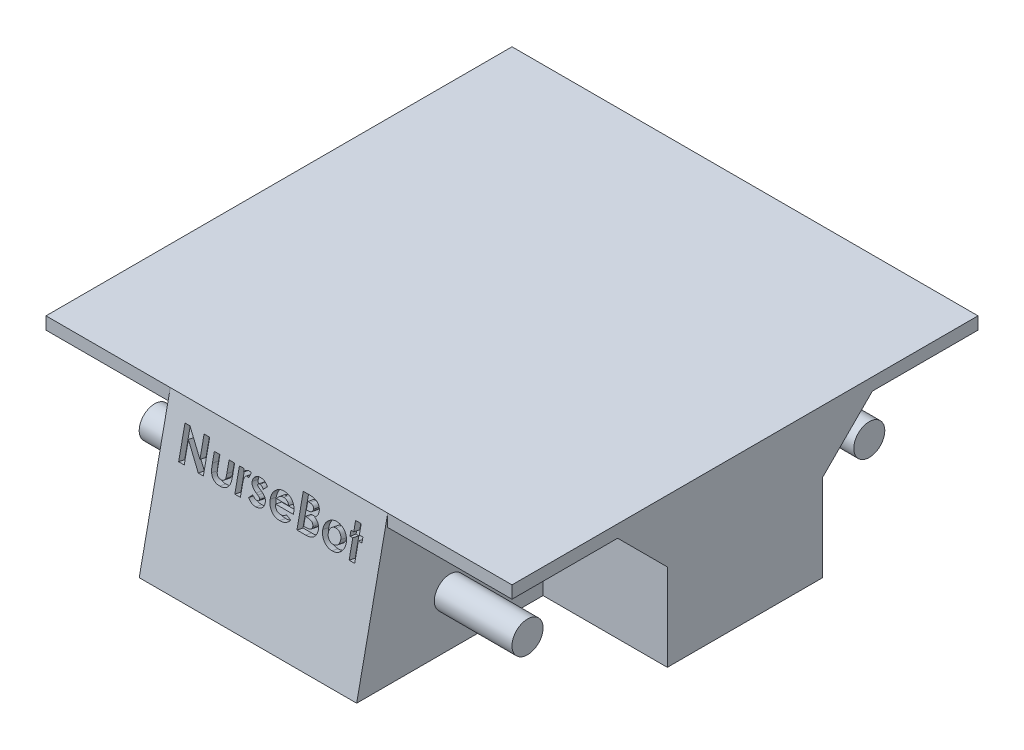
from build123d import *

# Parameters (mm, degrees)
SKETCH1_W                = 750
SKETCH1_H                = 750
BOSS_EXTRUDE1_DEPTH      = 20
BOSS_EXTRUDE5_DEPTH      = 220
BOSS_EXTRUDE6_DEPTH      = 300
BOSS_EXTRUDE6_DEPTH_BACK = 300
SKETCH7_R                = 25
CHAMFER2_SIZE            = 80
BOSS_EXTRUDE7_DEPTH      = 350
CUT_EXTRUDE1_DEPTH       = 10


with BuildPart() as part:
    # Sketch1 → Boss-Extrude1 (new body)
    with BuildSketch(Plane(origin=(0, 0, 0), x_dir=(1, 0, 0), z_dir=(0, 1, 0))):
        Rectangle(SKETCH1_W, SKETCH1_H)
    extrude(amount=BOSS_EXTRUDE1_DEPTH)

    # Sketch6 → Boss-Extrude5 (add)
    with BuildSketch(Plane(origin=(0, 0, 0), x_dir=(-1, 0, 0), z_dir=(0, -1, 0))):
        Polygon((175, -375), (175, -125), (375, -125), (375, 125), (175, 125), (175, 375), (-175, 375), (-175, 125), (-375, 125), (-375, -125), (-175, -125), (-175, -375), align=None)
    extrude(amount=BOSS_EXTRUDE5_DEPTH)

    # Sketch7 → Boss-Extrude6 (add, two sides: drawn at the far end of the back side and taken through both)
    with BuildSketch(Plane(origin=(0, 0, 0), x_dir=(0, 0, -1), z_dir=(1, 0, 0)).offset(-BOSS_EXTRUDE6_DEPTH_BACK)):
        with Locations((275, -140)):
            Circle(SKETCH7_R)
        with Locations((-275, -140)):
            Circle(SKETCH7_R)
    extrude(amount=BOSS_EXTRUDE6_DEPTH + BOSS_EXTRUDE6_DEPTH_BACK)

    # Chamfer2
    chamfer2_edges = [part.edges().sort_by_distance(p)[0] for p in [
        (-275, 0, 125),
        (-275, 0, -125),
        (275, 0, -125),
        (275, 0, 125),
    ]]
    chamfer(chamfer2_edges, length=CHAMFER2_SIZE)

    # Sketch8 → Boss-Extrude7 (add)
    with BuildSketch(Plane(origin=(175, 0, 0), x_dir=(0, 0, -1), z_dir=(1, 0, 0))):
        Polygon((-375, -220), (-375, 20), (-425, -220), align=None)
    extrude(amount=-BOSS_EXTRUDE7_DEPTH)

    # Sketch9 → Cut-Extrude1 (cut)
    # profile 1 of 8: a face of its own
    with BuildSketch(Plane(origin=(0, 75.707154742, 363.394342762), x_dir=(1, 0, 0), z_dir=(0, 0.20395425411200038, 0.9789804197376052))):
        Polygon((-144.839855601, -88.611910455), (-136.756922909, -88.611910455), (-114.070624832, -121.514554686), (-114.070624832, -88.611910455), (-105.096265857, -88.611910455), (-105.096265857, -138.611910455), (-113.239294703, -138.611910455), (-135.865496626, -105.809426481), (-135.865496626, -138.611910455), (-144.839855601, -138.611910455), align=None)
    # profile 2 of 8: a face of its own
    with BuildSketch(Plane(origin=(0, 75.707154742, 363.394342762), x_dir=(1, 0, 0), z_dir=(0, 0.20395425411200038, 0.9789804197376052))):
        with BuildLine():
            Line((-94.839855601, -102.073448917), (-85.865496626, -102.073448917))
            Line((-85.865496626, -102.073448917), (-85.865496626, -119.611509814))
            add(Edge.make_bspline(
                [(-85.865496626, -119.611509814), (-85.864699698, -120.022208867), (-85.863170199, -120.810440646), (-85.820609236, -121.942495795), (-85.760887789, -122.977708393), (-85.686359464, -123.917299141), (-85.575121164, -124.759008013), (-85.446701235, -125.501228161), (-85.301114464, -126.149307371), (-85.064371991, -126.871678058), (-84.693984114, -127.66217384), (-84.134632859, -128.501377945), (-83.457095342, -129.227044114), (-82.670525552, -129.845612261), (-81.766890681, -130.333057544), (-80.758640445, -130.663391773), (-79.658460692, -130.885410722), (-78.892187139, -130.907905039), (-78.493701755, -130.919602763)],
                knots=[0, 0, 0, 0, 1.267339619, 2.432334223, 3.495366327, 4.467371443, 5.340232306, 6.114347373, 6.791623365, 7.387877112, 8.457231658, 9.474542289, 10.487879852, 11.508108106, 12.54995813, 13.638205937, 14.771795776, 16, 16, 16, 16], degree=3))
            add(Edge.make_bspline(
                [(-78.493701755, -130.919602763), (-78.09556999, -130.906251466), (-77.327314729, -130.880488126), (-76.219815052, -130.679578744), (-75.209189995, -130.335313826), (-74.28505979, -129.868359094), (-73.474677091, -129.243419722), (-72.769110019, -128.498760124), (-72.1750391, -127.622368028), (-71.889560628, -126.968604634), (-71.742900473, -126.632743789)],
                knots=[0, 0, 0, 0, 1.116871431, 2.155171802, 3.144773418, 4.104381479, 5.046960687, 6.001340237, 6.973219418, 8, 8, 8, 8], degree=3))
            add(Edge.make_bspline(
                [(-71.742900473, -126.632743789), (-71.689081123, -126.48355139), (-71.570281115, -126.154226373), (-71.464546757, -125.586095404), (-71.350745103, -124.916076912), (-71.260723954, -124.130516486), (-71.20978681, -123.234279177), (-71.155212876, -122.226235416), (-71.12740102, -121.107389154), (-71.123794341, -120.322658314), (-71.121906883, -119.911990584)],
                knots=[0, 0, 0, 0, 0.56094539, 1.238222264, 2.041156151, 2.969685991, 4.036367568, 5.220421584, 6.545382566, 8, 8, 8, 8], degree=3))
            Line((-71.121906883, -119.911990584), (-71.121906883, -102.073448917))
            Line((-71.121906883, -102.073448917), (-62.147547909, -102.073448917))
            Line((-62.147547909, -102.073448917), (-62.147547909, -117.428016225))
            add(Edge.make_bspline(
                [(-62.147547909, -117.428016225), (-62.14910181, -118.189328234), (-62.152081109, -119.648993778), (-62.237466004, -121.74283657), (-62.355306835, -123.646557585), (-62.507063154, -125.365398368), (-62.72572526, -126.900072251), (-62.994144647, -128.246980378), (-63.291102183, -129.415023305), (-63.563423315, -130.10709681), (-63.690015857, -130.428817507)],
                knots=[0, 0, 0, 0, 1.388070971, 2.661352173, 3.82033814, 4.865898334, 5.806910977, 6.645039373, 7.370126333, 8, 8, 8, 8], degree=3))
            add(Edge.make_bspline(
                [(-63.690015857, -130.428817507), (-63.85227489, -130.775088375), (-64.172560282, -131.45859732), (-64.728314972, -132.430395667), (-65.32744966, -133.35109761), (-65.9984714, -134.199030731), (-66.727682558, -134.982812907), (-67.494470627, -135.72026141), (-68.333367758, -136.381346229), (-69.222618252, -136.983078937), (-70.174630361, -137.517231989), (-71.182883499, -137.990582068), (-72.258273445, -138.375807865), (-73.391475292, -138.702341061), (-74.587712362, -138.945853662), (-75.84457497, -139.130295878), (-77.163441598, -139.225616318), (-78.062884209, -139.243680292), (-78.523749832, -139.252936096)],
                knots=[0, 0, 0, 0, 0.997311338, 1.968606903, 2.91805772, 3.860812155, 4.785445165, 5.709667791, 6.633356648, 7.568312411, 8.508286151, 9.478643871, 10.470653671, 11.485274776, 12.552984541, 13.653035246, 14.797438149, 16, 16, 16, 16], degree=3))
            add(Edge.make_bspline(
                [(-78.523749832, -139.252936096), (-79.021614209, -139.247002867), (-79.995765969, -139.235393549), (-81.418988081, -139.093224892), (-82.775337888, -138.909277134), (-84.049671828, -138.59653223), (-85.259786568, -138.234201613), (-86.391789307, -137.771771369), (-87.450305692, -137.228084427), (-88.437418496, -136.606364064), (-89.345472033, -135.900912872), (-90.194657887, -135.142224676), (-90.95756069, -134.300113676), (-91.659086115, -133.400584589), (-92.291404742, -132.435358612), (-92.854830415, -131.407867794), (-93.349840386, -130.313438588), (-93.613952761, -129.546399986), (-93.748108806, -129.15678225)],
                knots=[0, 0, 0, 0, 1.211240017, 2.369985978, 3.478996442, 4.539426614, 5.559871561, 6.551301256, 7.510778031, 8.453136967, 9.386094087, 10.30661716, 11.221130616, 12.147659962, 13.080758632, 14.026335491, 14.997475882, 16, 16, 16, 16], degree=3))
            add(Edge.make_bspline(
                [(-93.748108806, -129.15678225), (-93.839634434, -128.854190203), (-94.036801974, -128.202336391), (-94.249682506, -127.119031442), (-94.419952099, -125.870461831), (-94.585584974, -124.455399415), (-94.701133495, -122.871471841), (-94.77665738, -121.121194596), (-94.827686536, -119.201145017), (-94.835679742, -117.865418021), (-94.839855601, -117.167599558)],
                knots=[0, 0, 0, 0, 0.627914866, 1.352675004, 2.190563461, 3.132055958, 4.183353232, 5.345633452, 6.613289997, 8, 8, 8, 8], degree=3))
            Line((-94.839855601, -117.167599558), (-94.839855601, -102.073448917))
        make_face()
    # profile 3 of 8: a face of its own
    with BuildSketch(Plane(origin=(0, 75.707154742, 363.394342762), x_dir=(1, 0, 0), z_dir=(0, 0.20395425411200038, 0.9789804197376052))):
        with BuildLine():
            Line((-54.455240216, -102.073448917), (-46.762932524, -102.073448917))
            Line((-46.762932524, -102.073448917), (-46.762932524, -106.57064443))
            add(Edge.make_bspline(
                [(-46.762932524, -106.57064443), (-46.545331907, -106.170977427), (-46.120022472, -105.38981169), (-45.338693372, -104.341251384), (-44.441070855, -103.45818315), (-43.459409275, -102.722136811), (-42.390733408, -102.148460963), (-41.26366049, -101.7396446), (-40.087832609, -101.473970613), (-39.28572269, -101.44637211), (-38.880320344, -101.432423276)],
                knots=[0, 0, 0, 0, 1.09866127, 2.147379032, 3.14564304, 4.131443017, 5.102343063, 6.064490016, 7.021754664, 8, 8, 8, 8], degree=3))
            add(Edge.make_bspline(
                [(-38.880320344, -101.432423276), (-38.585947656, -101.446207638), (-37.986499747, -101.474277521), (-37.07285678, -101.637448179), (-36.146031551, -101.932491757), (-35.536100683, -102.198139285), (-35.224470985, -102.333865584)],
                knots=[0, 0, 0, 0, 0.931404136, 1.896671404, 2.925354185, 4, 4, 4, 4], degree=3))
            Line((-35.224470985, -102.333865584), (-38.008926114, -109.936029045))
            add(Edge.make_bspline(
                [(-38.008926114, -109.936029045), (-38.25781664, -109.815777177), (-38.725635019, -109.589749955), (-39.404826075, -109.323014548), (-40.02122012, -109.160265639), (-40.41200263, -109.135982075), (-40.593060729, -109.124730968)],
                knots=[0, 0, 0, 0, 1.214386998, 2.282580073, 3.20428172, 4, 4, 4, 4], degree=3))
            add(Edge.make_bspline(
                [(-40.593060729, -109.124730968), (-40.764014785, -109.132186546), (-41.100310867, -109.146852952), (-41.596674475, -109.272539073), (-42.064145631, -109.489280894), (-42.525251745, -109.766948677), (-42.943616659, -110.152927661), (-43.361723157, -110.599766869), (-43.730180991, -111.151449304), (-44.119010862, -111.765499873), (-44.450085594, -112.517097217), (-44.733971985, -113.414349558), (-44.986917035, -114.467638724), (-45.160977765, -115.682557166), (-45.329214449, -117.04734845), (-45.429353054, -118.572029974), (-45.503987624, -120.251780548), (-45.508551028, -121.424307072), (-45.510929319, -122.03538802)],
                knots=[0, 0, 0, 0, 0.544232178, 1.070598461, 1.618251235, 2.182094276, 2.777567932, 3.425210017, 4.127676488, 4.886675562, 5.738955394, 6.734782583, 7.883056018, 9.186093582, 10.642914445, 12.264202625, 14.053029461, 16, 16, 16, 16], degree=3))
            Line((-45.510929319, -122.03538802), (-45.480881242, -123.818240584))
            Line((-45.480881242, -123.818240584), (-45.480881242, -138.611910455))
            Line((-45.480881242, -138.611910455), (-54.455240216, -138.611910455))
            Line((-54.455240216, -138.611910455), (-54.455240216, -102.073448917))
        make_face()
    # profile 4 of 8: a face of its own
    with BuildSketch(Plane(origin=(0, 75.707154742, 363.394342762), x_dir=(1, 0, 0), z_dir=(0, 0.20395425411200038, 0.9789804197376052))):
        with BuildLine():
            Line((-8.301394062, -107.712471353), (-13.790176114, -113.611910455))
            add(Edge.make_bspline(
                [(-13.790176114, -113.611910455), (-14.064257296, -113.308624767), (-14.588470775, -112.728554131), (-15.390990946, -111.93778821), (-16.181560029, -111.279313792), (-16.945445827, -110.726167839), (-17.698249615, -110.301971014), (-18.433713904, -109.9967709), (-19.152191568, -109.803025328), (-19.628428937, -109.777945697), (-19.859887652, -109.765756609)],
                knots=[0, 0, 0, 0, 1.327646587, 2.539285, 3.655602211, 4.666613517, 5.598770349, 6.454635452, 7.248928967, 8, 8, 8, 8], degree=3))
            add(Edge.make_bspline(
                [(-19.859887652, -109.765756609), (-20.094100623, -109.772894619), (-20.542545602, -109.786561686), (-21.175401956, -109.903790839), (-21.731408601, -110.106736111), (-22.201888697, -110.383369429), (-22.579880733, -110.724153265), (-22.844530585, -111.114001934), (-23.022245394, -111.540790224), (-23.037278916, -111.843954435), (-23.044983806, -111.999330327)],
                knots=[0, 0, 0, 0, 1.295068245, 2.479652818, 3.543291146, 4.55379989, 5.481948265, 6.332409746, 7.145336708, 8, 8, 8, 8], degree=3))
            add(Edge.make_bspline(
                [(-23.044983806, -111.999330327), (-23.018878932, -112.234791958), (-22.964714351, -112.72334749), (-22.592678796, -113.289999017), (-22.100448889, -113.708006247), (-21.533050134, -114.096985978), (-20.764645332, -114.531906966), (-20.181713943, -114.829710073), (-19.859887652, -114.994121994)],
                knots=[0, 0, 0, 0, 0.916701701, 1.902049539, 2.5493345, 3.440293453, 4.586830489, 6, 6, 6, 6], degree=3))
            Line((-19.859887652, -114.994121994), (-16.614695344, -116.636750199))
            add(Edge.make_bspline(
                [(-16.614695344, -116.636750199), (-16.201844834, -116.846382277), (-15.400837292, -117.253107888), (-14.274695726, -117.909414277), (-13.234573421, -118.545553562), (-12.301334929, -119.197510404), (-11.469268228, -119.853958133), (-10.744283449, -120.521388151), (-10.108796058, -121.178641664), (-9.400138414, -122.05983894), (-8.691268083, -123.233522014), (-8.100290387, -124.759842159), (-7.723431096, -126.394195434), (-7.681735957, -127.525393657), (-7.660368421, -128.105099558)],
                knots=[0, 0, 0, 0, 1.076693506, 2.088987655, 3.030641824, 3.911722491, 4.735175175, 5.493635918, 6.202154166, 6.859459289, 8.120623445, 9.372284821, 10.653373066, 12, 12, 12, 12], degree=3))
            add(Edge.make_bspline(
                [(-7.660368421, -128.105099558), (-7.673242499, -128.496193809), (-7.698440484, -129.261669047), (-7.857736834, -130.388375619), (-8.14387433, -131.459706748), (-8.520430842, -132.49236235), (-9.027641178, -133.467668863), (-9.643419381, -134.390354235), (-10.358042079, -135.272532819), (-11.190401358, -136.08402702), (-12.102237026, -136.840330734), (-13.115896248, -137.476436467), (-14.186559424, -138.035719608), (-15.342511778, -138.472469943), (-16.56753386, -138.826558425), (-17.87212664, -139.071932871), (-19.251863363, -139.226353297), (-20.196665378, -139.243924701), (-20.681201755, -139.252936096)],
                knots=[0, 0, 0, 0, 0.976600749, 1.911466839, 2.833459288, 3.740827163, 4.650527853, 5.570709661, 6.506801416, 7.479409329, 8.468875524, 9.458587492, 10.461481786, 11.480119772, 12.538142914, 13.641687514, 14.790552763, 16, 16, 16, 16], degree=3))
            add(Edge.make_bspline(
                [(-20.681201755, -139.252936096), (-21.32317084, -139.232492948), (-22.583299633, -139.192364848), (-24.423626508, -138.912838229), (-26.161383645, -138.428972945), (-27.798000747, -137.751139576), (-29.343501856, -136.887394044), (-30.775815487, -135.815674918), (-32.1197721, -134.563904999), (-32.901700021, -133.603855767), (-33.301394062, -133.113112379)],
                knots=[0, 0, 0, 0, 1.056901255, 2.07460411, 3.05625841, 4.019970729, 4.984811261, 5.963335951, 6.958928997, 8, 8, 8, 8], degree=3))
            Line((-33.301394062, -133.113112379), (-27.862692139, -127.073448917))
            add(Edge.make_bspline(
                [(-27.862692139, -127.073448917), (-27.597700215, -127.352947252), (-27.07160458, -127.907842859), (-26.184819932, -128.639547739), (-25.24653897, -129.306442906), (-24.246316383, -129.866417253), (-23.245891689, -130.318571341), (-22.286066735, -130.657750157), (-21.384930488, -130.870901143), (-20.79903493, -130.903927247), (-20.520945344, -130.919602763)],
                knots=[0, 0, 0, 0, 1.087861918, 2.159761696, 3.243809206, 4.338405912, 5.394481878, 6.343674753, 7.213841449, 8, 8, 8, 8], degree=3))
            add(Edge.make_bspline(
                [(-20.520945344, -130.919602763), (-20.243006285, -130.911553462), (-19.708730704, -130.896080484), (-18.94938676, -130.735131139), (-18.276345232, -130.464551515), (-17.705580958, -130.089386), (-17.230834507, -129.658753284), (-16.89632379, -129.169336678), (-16.675127595, -128.650368795), (-16.648243788, -128.287526203), (-16.634727396, -128.105099558)],
                knots=[0, 0, 0, 0, 1.255011871, 2.412479185, 3.488767498, 4.514443302, 5.48617286, 6.365347346, 7.178144445, 8, 8, 8, 8], degree=3))
            add(Edge.make_bspline(
                [(-16.634727396, -128.105099558), (-16.646788026, -127.933306466), (-16.671550824, -127.580582131), (-16.867598696, -127.059935775), (-17.175397713, -126.544412344), (-17.602298155, -126.032558341), (-18.153980476, -125.528526856), (-18.828470345, -125.036355012), (-19.610207259, -124.529784839), (-20.187642639, -124.227430281), (-20.490897268, -124.068641225)],
                knots=[0, 0, 0, 0, 0.704666567, 1.446816302, 2.258757648, 3.165368109, 4.175243826, 5.322435858, 6.59381024, 8, 8, 8, 8], degree=3))
            Line((-20.490897268, -124.068641225), (-23.465656883, -122.566237379))
            add(Edge.make_bspline(
                [(-23.465656883, -122.566237379), (-24.140451115, -122.204385716), (-25.435803038, -121.509766194), (-27.186634608, -120.318641333), (-28.668460772, -119.05066521), (-29.882489098, -117.712649831), (-30.849829271, -116.308349986), (-31.524613943, -114.819886192), (-31.949115136, -113.261369421), (-31.99581706, -112.195638745), (-32.01934278, -111.658785455)],
                knots=[0, 0, 0, 0, 1.255999728, 2.41104856, 3.467751088, 4.449286722, 5.368722015, 6.253902015, 7.120417131, 8, 8, 8, 8], degree=3))
            add(Edge.make_bspline(
                [(-32.01934278, -111.658785455), (-32.011184257, -111.310847612), (-31.99516775, -110.627789095), (-31.824662406, -109.624670326), (-31.56706542, -108.660418178), (-31.203568325, -107.733501333), (-30.737934893, -106.843000044), (-30.167453156, -105.992866279), (-29.48516329, -105.184645592), (-28.712908267, -104.420941438), (-27.856067078, -103.725403183), (-26.939120988, -103.108993645), (-25.96478215, -102.583927339), (-24.925054297, -102.16530713), (-23.833152929, -101.832111497), (-22.681870339, -101.605628873), (-21.476118425, -101.461585132), (-20.651576412, -101.442281627), (-20.230480601, -101.432423276)],
                knots=[0, 0, 0, 0, 0.959035663, 1.882742823, 2.798841253, 3.708806893, 4.623422363, 5.566085165, 6.527241613, 7.536786942, 8.55815439, 9.567237405, 10.580975912, 11.605536372, 12.654523293, 13.725718749, 14.838518481, 16, 16, 16, 16], degree=3))
            add(Edge.make_bspline(
                [(-20.230480601, -101.432423276), (-19.648312922, -101.451590637), (-18.49281277, -101.489634469), (-16.788677305, -101.797485383), (-15.142659212, -102.314911712), (-13.559373047, -103.027838665), (-12.059184814, -103.923785234), (-10.675084381, -105.011766962), (-9.397704632, -106.264992808), (-8.670459782, -107.225187252), (-8.301394062, -107.712471353)],
                knots=[0, 0, 0, 0, 0.996590028, 1.978055413, 2.954661574, 3.945146934, 4.945404762, 5.939399542, 6.954276554, 8, 8, 8, 8], degree=3))
        make_face()
    # profile 5 of 8: a face of its own
    with BuildSketch(Plane(origin=(0, 75.707154742, 363.394342762), x_dir=(1, 0, 0), z_dir=(0, 0.20395425411200038, 0.9789804197376052))):
        with BuildLine():
            Line((36.540352732, -122.58626943), (7.724246963, -122.58626943))
            add(Edge.make_bspline(
                [(7.724246963, -122.58626943), (7.783000676, -122.921096231), (7.898456357, -123.579057311), (8.149172473, -124.534802874), (8.469123839, -125.43548136), (8.852565402, -126.282296757), (9.293032339, -127.079725843), (9.806800533, -127.824028368), (10.387353296, -128.51454691), (11.03133403, -129.148280407), (11.728008746, -129.716119354), (12.473998829, -130.213582169), (13.270074091, -130.621471245), (14.107107833, -130.965279411), (14.991354621, -131.237610308), (15.924115843, -131.425431749), (16.902918892, -131.536378562), (17.569709431, -131.552425749), (17.91054504, -131.560628404)],
                knots=[0, 0, 0, 0, 1.091296461, 2.144483647, 3.168565212, 4.157007626, 5.126487748, 6.090021542, 7.05641414, 8.019231907, 8.98705074, 9.938580405, 10.892824166, 11.854447369, 12.841318655, 13.858982407, 14.905600794, 16, 16, 16, 16], degree=3))
            add(Edge.make_bspline(
                [(17.91054504, -131.560628404), (18.321956758, -131.549766737), (19.132147589, -131.528376916), (20.319083189, -131.338680977), (21.467022813, -131.052153598), (22.565102906, -130.626063335), (23.626043001, -130.095655859), (24.63237677, -129.434833409), (25.601523057, -128.662907374), (26.192816501, -128.067907083), (26.494279015, -127.764554686)],
                knots=[0, 0, 0, 0, 1.021034703, 2.010718019, 2.977989445, 3.954245119, 4.929443971, 5.918328161, 6.938689359, 8, 8, 8, 8], degree=3))
            Line((26.494279015, -127.764554686), (34.006298245, -131.34027584))
            add(Edge.make_bspline(
                [(34.006298245, -131.34027584), (33.769786704, -131.667098491), (33.301147783, -132.314685555), (32.536110472, -133.226007805), (31.737745321, -134.076308437), (30.905456915, -134.85999489), (30.038189702, -135.57483397), (29.138356208, -136.229533708), (28.192805738, -136.806515678), (27.220444401, -137.333693922), (26.201171687, -137.785641384), (25.137808378, -138.171046227), (24.03485841, -138.519448926), (22.878393911, -138.784912696), (21.678044749, -138.995051652), (20.430939454, -139.144278149), (19.137242389, -139.236448206), (18.257924032, -139.247374853), (17.810384784, -139.252936096)],
                knots=[0, 0, 0, 0, 1.028154879, 2.037251081, 3.030720504, 4.000128189, 4.949298328, 5.894184978, 6.834267904, 7.770992897, 8.712077017, 9.673380525, 10.653304757, 11.658697181, 12.695551717, 13.758623199, 14.859225354, 16, 16, 16, 16], degree=3))
            add(Edge.make_bspline(
                [(17.810384784, -139.252936096), (17.121852999, -139.238899005), (15.773403183, -139.211408169), (13.801051564, -138.956253878), (11.927864579, -138.533180559), (10.148552999, -137.958077361), (8.470808196, -137.198760973), (6.893799849, -136.27005404), (5.401771389, -135.189761737), (4.040312616, -133.935211601), (2.799983505, -132.569708362), (1.710555535, -131.103251128), (0.798937721, -129.546085485), (0.05029884, -127.908517076), (-0.531569307, -126.186354371), (-0.951062489, -124.378845853), (-1.208216836, -122.486854821), (-1.235990783, -121.198197726), (-1.250112011, -120.543000199)],
                knots=[0, 0, 0, 0, 1.103565453, 2.161269334, 3.182010356, 4.179077853, 5.15417608, 6.128274628, 7.109042802, 8.101804412, 9.090965879, 10.063106201, 11.02526161, 11.978650795, 12.945248442, 13.93468508, 14.949922959, 16, 16, 16, 16], degree=3))
            add(Edge.make_bspline(
                [(-1.250112011, -120.543000199), (-1.2358518, -119.871153263), (-1.207795476, -118.549324587), (-0.953276587, -116.613646616), (-0.530409552, -114.766748019), (0.053160686, -113.006085423), (0.790442625, -111.326152231), (1.71365921, -109.741645843), (2.799442882, -108.247049872), (4.035303731, -106.849356188), (5.402530063, -105.587784936), (6.855337214, -104.463472837), (8.410048961, -103.526621367), (10.049080174, -102.76964596), (11.761947017, -102.15462255), (13.568447841, -101.745375835), (15.454837924, -101.470591164), (16.744332646, -101.445285211), (17.399727732, -101.432423276)],
                knots=[0, 0, 0, 0, 1.079208495, 2.12329425, 3.130605359, 4.119693003, 5.099659317, 6.073216462, 7.060498243, 8.06384408, 9.066070512, 10.045757761, 11.010926815, 11.975797609, 12.942977511, 13.929384301, 14.947594487, 16, 16, 16, 16], degree=3))
            add(Edge.make_bspline(
                [(17.399727732, -101.432423276), (18.091558052, -101.446678143), (19.449895584, -101.474666104), (21.435984024, -101.727748602), (23.321608745, -102.153401771), (25.114803566, -102.723532158), (26.792668651, -103.502029677), (28.392071787, -104.407882604), (29.874650213, -105.511526245), (31.256206638, -106.759937015), (32.503343666, -108.145005502), (33.593479612, -109.649614095), (34.521051131, -111.259078697), (35.272857053, -112.979926031), (35.854127727, -114.806989943), (36.274009227, -116.737897634), (36.529202099, -118.779993348), (36.556459235, -120.178333322), (36.570400809, -120.893561096)],
                knots=[0, 0, 0, 0, 1.080001299, 2.120471247, 3.119684163, 4.095710327, 5.052285597, 6.002875087, 6.961153713, 7.931888285, 8.906493152, 9.865905668, 10.82813294, 11.801621613, 12.7925306, 13.817193356, 14.883530496, 16, 16, 16, 16], degree=3))
            Line((36.570400809, -120.893561096), (36.540352732, -122.58626943))
        make_face()
        with BuildLine():
            add(Edge.make_bspline(
                [(27.596041835, -115.534987379), (27.426690192, -115.077975896), (27.08997501, -114.169318016), (26.329349429, -112.915591859), (25.320023617, -111.829814087), (24.146105289, -110.868566416), (22.804830095, -110.088357763), (21.338463962, -109.523461358), (19.765541479, -109.184742388), (18.683455569, -109.145016603), (18.130897604, -109.124730968)],
                knots=[0, 0, 0, 0, 0.954238005, 1.897273737, 2.851915805, 3.847685534, 4.862635127, 5.880135777, 6.917509367, 8, 8, 8, 8], degree=3))
            add(Edge.make_bspline(
                [(18.130897604, -109.124730968), (17.527414341, -109.14421779), (16.347730222, -109.182310468), (14.646116197, -109.587440082), (13.041026267, -110.192083932), (12.094756214, -110.815484579), (11.620480938, -111.127936096)],
                knots=[0, 0, 0, 0, 1.044195649, 2.041185066, 3.018232172, 4, 4, 4, 4], degree=3))
            add(Edge.make_bspline(
                [(11.620480938, -111.127936096), (11.324568587, -111.365906016), (10.693698582, -111.87324572), (9.874385892, -112.885340264), (9.067356071, -114.110759554), (8.608515125, -115.041552079), (8.365272604, -115.534987379)],
                knots=[0, 0, 0, 0, 0.82159062, 1.751589201, 2.808063854, 4, 4, 4, 4], degree=3))
            Line((8.365272604, -115.534987379), (27.596041835, -115.534987379))
        make_face(mode=Mode.SUBTRACT)
    # profile 6 of 8: a face of its own
    with BuildSketch(Plane(origin=(0, 75.707154742, 363.394342762), x_dir=(1, 0, 0), z_dir=(0, 0.20395425411200038, 0.9789804197376052))):
        with BuildLine():
            Line((45.544759784, -138.611910455), (45.544759784, -88.611910455))
            Line((45.544759784, -88.611910455), (53.557580297, -88.611910455))
            add(Edge.make_bspline(
                [(53.557580297, -88.611910455), (54.118527834, -88.611846437), (55.203950686, -88.611722564), (56.76993259, -88.666714707), (58.222248555, -88.737853205), (59.556276749, -88.817440641), (60.774287779, -88.954585696), (61.874429462, -89.099121602), (62.858899888, -89.273422997), (63.467544456, -89.429776748), (63.753894399, -89.503336738)],
                knots=[0, 0, 0, 0, 1.311965854, 2.538629056, 3.664479157, 4.713267157, 5.663616078, 6.530575999, 7.308677837, 8, 8, 8, 8], degree=3))
            add(Edge.make_bspline(
                [(63.753894399, -89.503336738), (64.129900948, -89.607094413), (64.867746505, -89.81070028), (65.924576807, -90.221891129), (66.927127767, -90.67895891), (67.874175299, -91.200387764), (68.759904154, -91.792472796), (69.58094826, -92.459912973), (70.355015508, -93.175917274), (71.054620535, -93.960440536), (71.686948212, -94.789434687), (72.236327592, -95.662682509), (72.71366786, -96.56683147), (73.095665104, -97.513259686), (73.383492851, -98.497608599), (73.594008865, -99.515674885), (73.730451748, -100.570679958), (73.743343811, -101.288434391), (73.749887989, -101.65277584)],
                knots=[0, 0, 0, 0, 1.099996261, 2.158545794, 3.195537121, 4.207578794, 5.205712374, 6.197378256, 7.190519799, 8.17788031, 9.159561366, 10.129234751, 11.085776129, 12.040971148, 13.00380137, 13.975669004, 14.972423361, 16, 16, 16, 16], degree=3))
            add(Edge.make_bspline(
                [(73.749887989, -101.65277584), (73.732776907, -102.120858968), (73.699095845, -103.042223094), (73.483938928, -104.3955403), (73.080486187, -105.674619577), (72.552578086, -106.903033873), (71.834788117, -108.076201193), (70.923333677, -109.19356373), (69.832977344, -110.289526751), (68.996613845, -110.946482655), (68.561586707, -111.288192507)],
                knots=[0, 0, 0, 0, 0.986156485, 1.941127874, 2.875419072, 3.804401753, 4.751181392, 5.761612777, 6.835722519, 8, 8, 8, 8], degree=3))
            add(Edge.make_bspline(
                [(68.561586707, -111.288192507), (68.91411183, -111.468153525), (69.605316064, -111.821007292), (70.586623012, -112.400993553), (71.495206128, -113.017882498), (72.335139223, -113.659262075), (73.088803739, -114.352321294), (73.787319749, -115.057125129), (74.396226099, -115.81405591), (74.94072851, -116.596135183), (75.414001155, -117.414687546), (75.826169441, -118.268330648), (76.174313207, -119.159980721), (76.469130354, -120.085099986), (76.689005059, -121.046870423), (76.832368043, -122.045635999), (76.942135705, -123.077990416), (76.950674597, -123.781204465), (76.955016194, -124.138753404)],
                knots=[0, 0, 0, 0, 1.164658916, 2.283573913, 3.35186032, 4.395461096, 5.390182219, 6.362969632, 7.312859996, 8.245001507, 9.165155236, 10.092416118, 11.032087915, 11.979892451, 12.947605196, 13.931445124, 14.948243989, 16, 16, 16, 16], degree=3))
            add(Edge.make_bspline(
                [(76.955016194, -124.138753404), (76.926842132, -124.821651436), (76.871240733, -126.169347962), (76.464710436, -128.148075983), (75.759916075, -130.024089617), (74.813522582, -131.789932783), (73.64738371, -133.39448722), (72.306658418, -134.800062978), (70.804844736, -135.989851652), (69.419240095, -136.792866706), (68.220801198, -137.3317649), (67.228156652, -137.664945746), (66.162077449, -137.973603979), (65.00303558, -138.190350163), (63.772042893, -138.388740105), (62.457097132, -138.511230164), (61.060655906, -138.594238659), (60.101519708, -138.605900765), (59.607259784, -138.611910455)],
                knots=[0, 0, 0, 0, 1.284142165, 2.534249414, 3.780121997, 5.041676246, 6.291546858, 7.49970053, 8.684500223, 9.883330709, 10.50184324, 11.153274765, 11.851151195, 12.587658647, 13.369265475, 14.195992086, 15.070362669, 16, 16, 16, 16], degree=3))
            Line((59.607259784, -138.611910455), (45.544759784, -138.611910455))
        make_face()
        with BuildLine():
            Line((54.519118758, -97.58626943), (54.519118758, -108.483705327))
            Line((54.519118758, -108.483705327), (56.902932861, -108.483705327))
            add(Edge.make_bspline(
                [(56.902932861, -108.483705327), (57.226914615, -108.480880084), (57.852341783, -108.475426122), (58.755704989, -108.405180991), (59.595686882, -108.285338434), (60.369101593, -108.11812792), (61.083153761, -107.905794947), (61.733281814, -107.650312652), (62.316627257, -107.338596482), (62.994339741, -106.874281492), (63.71073071, -106.191021197), (64.341361622, -105.203910134), (64.712799018, -104.068736168), (64.754167126, -103.268123589), (64.775529015, -102.854698917)],
                knots=[0, 0, 0, 0, 1.065314748, 2.056525647, 2.977365736, 3.853934255, 4.656397591, 5.425096493, 6.14721249, 6.826394842, 8.123232004, 9.372140726, 10.643011755, 12, 12, 12, 12], degree=3))
            add(Edge.make_bspline(
                [(64.775529015, -102.854698917), (64.758435593, -102.467458022), (64.72538615, -101.718743313), (64.351396448, -100.667481182), (63.770516505, -99.73584778), (63.084706087, -99.098220905), (62.438882314, -98.662740548), (61.885888369, -98.375995277), (61.278935989, -98.119303842), (60.606275227, -97.923031314), (59.871747345, -97.77575532), (59.078920354, -97.66759874), (58.226426355, -97.593982771), (57.637606937, -97.588895694), (57.333621963, -97.58626943)],
                knots=[0, 0, 0, 0, 1.347982417, 2.606269829, 3.849316587, 5.153353503, 5.842674298, 6.568177932, 7.326619318, 8.142485038, 9.012069166, 9.942760135, 10.937925643, 12, 12, 12, 12], degree=3))
            Line((57.333621963, -97.58626943), (54.519118758, -97.58626943))
        make_face(mode=Mode.SUBTRACT)
        with BuildLine():
            Line((54.519118758, -116.817038661), (54.519118758, -129.637551481))
            Line((54.519118758, -129.637551481), (57.103253374, -129.637551481))
            add(Edge.make_bspline(
                [(57.103253374, -129.637551481), (57.614140077, -129.634632804), (58.596383516, -129.629021284), (60.003445501, -129.561220775), (61.282816611, -129.439022303), (62.431106996, -129.286467355), (63.450075478, -129.079779261), (64.336277702, -128.817001839), (65.101866782, -128.527900905), (65.742252207, -128.170826925), (66.265410414, -127.755281361), (66.737505844, -127.330583813), (67.122423041, -126.840655067), (67.42697671, -126.306526407), (67.690567373, -125.741465973), (67.849546647, -125.12340836), (67.970587887, -124.470671313), (67.97724911, -124.019187214), (67.98065722, -123.788192507)],
                knots=[0, 0, 0, 0, 1.753078804, 3.370512758, 4.83203934, 6.162291463, 7.344201807, 8.395507345, 9.331626367, 10.147333109, 10.898971645, 11.62040215, 12.321813352, 13.025280112, 13.727906689, 14.453419512, 15.208716525, 16, 16, 16, 16], degree=3))
            add(Edge.make_bspline(
                [(67.98065722, -123.788192507), (67.97314136, -123.524046426), (67.958502486, -123.009560919), (67.838946628, -122.257585444), (67.621674581, -121.555566444), (67.348009836, -120.885552347), (66.967190804, -120.271531991), (66.514600398, -119.69225646), (65.967755648, -119.167341811), (65.352796825, -118.665039245), (64.635508242, -118.225246135), (63.815553369, -117.843647712), (62.888477764, -117.524950762), (61.851409713, -117.271204041), (60.70889564, -117.055852706), (59.45259645, -116.927264186), (58.092975037, -116.831627253), (57.150191422, -116.822012021), (56.662548245, -116.817038661)],
                knots=[0, 0, 0, 0, 0.845221588, 1.646264278, 2.427170338, 3.19324141, 3.95557735, 4.731569926, 5.540061037, 6.376114724, 7.268642756, 8.224665384, 9.265483498, 10.400594375, 11.639216012, 12.983232105, 14.439614077, 16, 16, 16, 16], degree=3))
            Line((56.662548245, -116.817038661), (54.519118758, -116.817038661))
        make_face(mode=Mode.SUBTRACT)
    # profile 7 of 8: a face of its own
    with BuildSketch(Plane(origin=(0, 75.707154742, 363.394342762), x_dir=(1, 0, 0), z_dir=(0, 0.20395425411200038, 0.9789804197376052))):
        with BuildLine():
            add(Edge.make_bspline(
                [(102.05517645, -101.432423276), (102.479466818, -101.439973813), (103.319754, -101.454927299), (104.571256785, -101.579401409), (105.800880417, -101.782486053), (107.015692605, -102.045445217), (108.204412688, -102.413890336), (109.373275354, -102.855783285), (110.532731722, -103.363128067), (111.654004317, -103.967045816), (112.745193495, -104.622049692), (113.779705777, -105.344572711), (114.748950251, -106.128939699), (115.670919393, -106.956964491), (116.502647955, -107.864696584), (117.297287853, -108.808397641), (118.011906629, -109.821877176), (118.673540676, -110.880439036), (119.262588709, -111.977961767), (119.774068593, -113.106810608), (120.217985044, -114.251378426), (120.565562729, -115.425606841), (120.853325015, -116.61401209), (121.03492347, -117.831157192), (121.164027381, -119.064539009), (121.178504021, -119.894953144), (121.185785425, -120.312631609)],
                knots=[0, 0, 0, 0, 1.022364134, 2.024744242, 3.027414945, 4.024939316, 5.017584196, 6.023349371, 7.035562955, 8.064994934, 9.090267829, 10.101425541, 11.102933353, 12.093946398, 13.084502048, 14.067315274, 15.065326281, 16.070028806, 17.074376865, 18.064572984, 19.055292013, 20.030201733, 21.013838017, 21.999348303, 22.993720005, 24, 24, 24, 24], degree=3))
            add(Edge.make_bspline(
                [(121.185785425, -120.312631609), (121.178101109, -120.733573188), (121.162822948, -121.570500472), (121.03959429, -122.815483769), (120.835732304, -124.038352537), (120.571763892, -125.246310904), (120.204697598, -126.423901891), (119.775819814, -127.588483649), (119.249355463, -128.724182496), (118.667310331, -129.843387837), (118.001422256, -130.913164872), (117.287422063, -131.936797026), (116.496110509, -132.887429618), (115.671040165, -133.794544409), (114.773076079, -134.627466837), (113.816551435, -135.399721342), (112.809747081, -136.120749079), (111.74542303, -136.77363338), (110.637211494, -137.347299532), (109.503802256, -137.864506383), (108.338567769, -138.295118017), (107.143919546, -138.646269946), (105.919133076, -138.918158095), (104.66691237, -139.102854949), (103.389954246, -139.231309482), (102.529590144, -139.245680816), (102.095240553, -139.252936096)],
                knots=[0, 0, 0, 0, 1.012026251, 2.012137606, 3.004615893, 3.992048833, 4.982446996, 5.968083444, 6.973977695, 7.990229942, 8.999482246, 10.001782172, 10.988562221, 11.971415814, 12.948383116, 13.930088534, 14.925840678, 15.924049238, 16.929462851, 17.924729459, 18.917889337, 19.913673841, 20.916777188, 21.931792057, 22.95587778, 24, 24, 24, 24], degree=3))
            add(Edge.make_bspline(
                [(102.095240553, -139.252936096), (101.46013288, -139.234294434), (100.208325988, -139.197551433), (98.364710393, -138.945871491), (96.593604395, -138.512664325), (94.892121997, -137.908783087), (93.258052931, -137.134931783), (91.705658047, -136.177173281), (90.219495245, -135.0543631), (88.825305987, -133.77599133), (87.548039757, -132.373501738), (86.432194032, -130.876352643), (85.484750712, -129.306983796), (84.70656221, -127.663605585), (84.105959373, -125.943964497), (83.672221649, -124.153201656), (83.420234, -122.286283488), (83.383801758, -121.017845432), (83.365272604, -120.372727763)],
                knots=[0, 0, 0, 0, 1.029999031, 2.030143771, 3.011211297, 3.982305373, 4.953580601, 5.938004764, 6.935448627, 7.970290061, 9.001484052, 10.007591832, 10.993831261, 11.969999897, 12.951306496, 13.942897864, 14.953773953, 16, 16, 16, 16], degree=3))
            add(Edge.make_bspline(
                [(83.365272604, -120.372727763), (83.384447924, -119.683883511), (83.422136632, -118.329973924), (83.72140156, -116.346465526), (84.199295364, -114.447350238), (84.885281817, -112.637940487), (85.761569178, -110.91489906), (86.831317452, -109.281860043), (88.099813401, -107.738453534), (89.071227291, -106.804948367), (89.565192476, -106.330259814)],
                knots=[0, 0, 0, 0, 1.043912699, 2.05178951, 3.033892, 4.007821512, 4.978932272, 5.95884105, 6.962068106, 8, 8, 8, 8], degree=3))
            add(Edge.make_bspline(
                [(89.565192476, -106.330259814), (90.018454909, -105.936796398), (90.912647859, -105.16057453), (92.365417102, -104.176064346), (93.852888874, -103.325747905), (95.392891166, -102.626629639), (96.989717105, -102.099505746), (98.635183866, -101.715806714), (100.328949296, -101.480127525), (101.476843239, -101.448405501), (102.05517645, -101.432423276)],
                knots=[0, 0, 0, 0, 1.048115528, 2.067714963, 3.060638214, 4.039924844, 5.017819947, 5.994373833, 6.98952318, 8, 8, 8, 8], degree=3))
        make_face()
        with BuildLine():
            add(Edge.make_bspline(
                [(102.255496963, -109.765756609), (101.908034411, -109.777305114), (101.224050638, -109.800038469), (100.217208552, -109.922042315), (99.264926705, -110.172099674), (98.348291004, -110.490104197), (97.483516823, -110.915390443), (96.64692108, -111.413073356), (95.882004911, -112.03586228), (95.151751578, -112.719016168), (94.488844325, -113.477640227), (93.923984397, -114.304160571), (93.419269538, -115.166956265), (93.036569854, -116.097615334), (92.719849282, -117.070700164), (92.505496596, -118.101932848), (92.356322095, -119.179793952), (92.345248001, -119.918136198), (92.339631579, -120.292599558)],
                knots=[0, 0, 0, 0, 1.030650113, 2.02884584, 2.99876339, 3.944280128, 4.900564847, 5.851248946, 6.823638398, 7.81794922, 8.81432732, 9.802856497, 10.78262424, 11.771747962, 12.779760563, 13.812642396, 14.89064281, 16, 16, 16, 16], degree=3))
            add(Edge.make_bspline(
                [(92.339631579, -120.292599558), (92.346203557, -120.680268381), (92.359047226, -121.437892649), (92.492046113, -122.544125959), (92.711365659, -123.59393404), (93.022950001, -124.585695161), (93.414819922, -125.526528064), (93.895598872, -126.41115404), (94.470360935, -127.234254175), (95.122001612, -127.99481488), (95.835520321, -128.68518425), (96.617338342, -129.27763341), (97.434716079, -129.792393099), (98.306490349, -130.20582458), (99.220279463, -130.525027227), (100.178796081, -130.760045399), (101.187077209, -130.886661797), (101.874565592, -130.908471455), (102.225448886, -130.919602763)],
                knots=[0, 0, 0, 0, 1.141730614, 2.231293227, 3.276944405, 4.297399982, 5.28939179, 6.275415646, 7.257752684, 8.24146775, 9.222424823, 10.176631434, 11.126518621, 12.063689483, 13.012557477, 13.974037417, 14.965980454, 16, 16, 16, 16], degree=3))
            add(Edge.make_bspline(
                [(102.225448886, -130.919602763), (102.576507675, -130.909729796), (103.264786696, -130.890373048), (104.274251861, -130.74542158), (105.237663369, -130.517296539), (106.159256957, -130.195346625), (107.031581453, -129.773065864), (107.857976195, -129.255843497), (108.645711079, -128.655153901), (109.368805279, -127.951758574), (110.038159751, -127.188825952), (110.625143588, -126.36138073), (111.115649419, -125.476754527), (111.517952032, -124.540513422), (111.830147186, -123.553944269), (112.045835854, -122.513380116), (112.195090111, -121.422045747), (112.205913753, -120.673731183), (112.21142645, -120.292599558)],
                knots=[0, 0, 0, 0, 1.031504075, 2.022346795, 2.991027682, 3.937587355, 4.885570121, 5.833146507, 6.798790848, 7.791235734, 8.792807298, 9.778388351, 10.766749885, 11.760164525, 12.768777521, 13.802286646, 14.880660483, 16, 16, 16, 16], degree=3))
            add(Edge.make_bspline(
                [(112.21142645, -120.292599558), (112.204770869, -119.91160114), (112.191710458, -119.163958649), (112.058702094, -118.071148267), (111.841534888, -117.033947508), (111.525931794, -116.056785133), (111.136391093, -115.128513269), (110.655279831, -114.253883392), (110.077683224, -113.437203278), (109.422874739, -112.68252248), (108.698659938, -112.001840562), (107.930416164, -111.394837532), (107.100576043, -110.892799391), (106.224707875, -110.47894075), (105.300481392, -110.160535603), (104.328934192, -109.92418552), (103.307088784, -109.799370819), (102.609691037, -109.777078449), (102.255496963, -109.765756609)],
                knots=[0, 0, 0, 0, 1.123894411, 2.205445421, 3.243160173, 4.246488011, 5.231014757, 6.210004299, 7.185865357, 8.177612767, 9.153374344, 10.115157457, 11.061423229, 12.009021698, 12.96873347, 13.94135618, 14.954456845, 16, 16, 16, 16], degree=3))
        make_face(mode=Mode.SUBTRACT)
    # profile 8 of 8: a face of its own
    with BuildSketch(Plane(origin=(0, 75.707154742, 363.394342762), x_dir=(1, 0, 0), z_dir=(0, 0.20395425411200038, 0.9789804197376052))):
        Polygon((129.519118758, -87.329859173), (138.493477732, -87.329859173), (138.493477732, -102.073448917), (144.262708502, -102.073448917), (144.262708502, -109.765756609), (138.493477732, -109.765756609), (138.493477732, -138.611910455), (129.519118758, -138.611910455), (129.519118758, -109.765756609), (125.031939271, -109.765756609), (125.031939271, -102.073448917), (129.519118758, -102.073448917), align=None)
    extrude(amount=-CUT_EXTRUDE1_DEPTH, mode=Mode.SUBTRACT)


solid = part.part
